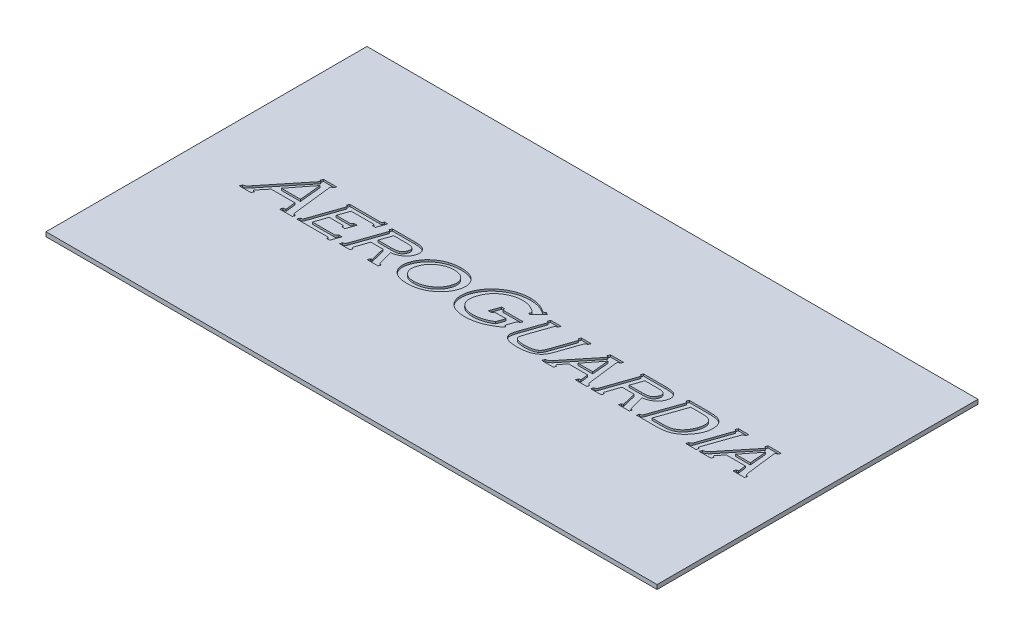
from build123d import *

# Parameters (mm, degrees)
CROQUIS1_W              = 127
CROQUIS1_H              = 66.7
SALIENTE_EXTRUIR1_DEPTH = 0.9
CORTAR_EXTRUIR1_DEPTH   = 0.4


with BuildPart() as part:
    # Croquis1 → Saliente-Extruir1 (new body)
    with BuildSketch(Plane(origin=(0, 0, 0), x_dir=(1, 0, 0), z_dir=(0, 1, 0))):
        Rectangle(CROQUIS1_W, CROQUIS1_H)
    extrude(amount=SALIENTE_EXTRUIR1_DEPTH)

    # Croquis3 → Cortar-Extruir1 (cut)
    # profile 1 of 11: a face of its own
    with BuildSketch(Plane(origin=(0, 0.9, 0), x_dir=(1, 0, 0), z_dir=(0, 1, 0))):
        with BuildLine():
            Line((-42.857045265, -2.280671296), (-47.783704065, -2.280671296))
            Line((-47.783704065, -2.280671296), (-49.202853733, -4.009994394))
            add(Edge.make_bspline(
                [(-49.202853733, -4.009994394), (-49.22631636, -4.040358554), (-49.269957104, -4.096836224), (-49.329113463, -4.176379412), (-49.369059133, -4.248760996), (-49.389338808, -4.293855725), (-49.398305483, -4.313794397)],
                knots=[0, 0, 0, 0, 1.27060263, 2.36333477, 3.276347104, 4, 4, 4, 4], degree=3))
            add(Edge.make_bspline(
                [(-49.398305483, -4.313794397), (-49.398620172, -4.332729031), (-49.39939745, -4.379497467), (-49.314916063, -4.426189025), (-49.201295383, -4.465755337), (-49.103243684, -4.485122136), (-49.045642542, -4.496499295)],
                knots=[0, 0, 0, 0, 0.499150711, 1.232899418, 2.374447809, 4, 4, 4, 4], degree=3))
            Line((-49.045642542, -4.496499295), (-49.219849537, -5))
            Line((-49.219849537, -5), (-51.66724537, -5))
            Line((-51.66724537, -5), (-51.486664949, -4.477379015))
            add(Edge.make_bspline(
                [(-51.486664949, -4.477379015), (-51.427750472, -4.466070937), (-51.317542811, -4.444917615), (-51.165432207, -4.404608003), (-51.040049772, -4.350775925), (-50.928355951, -4.283861408), (-50.820043751, -4.180665363), (-50.689629293, -4.039231537), (-50.524950857, -3.852101659), (-50.40956212, -3.707478423), (-50.345821578, -3.627588795)],
                knots=[0, 0, 0, 0, 0.977889715, 1.829277695, 2.558265342, 3.19570352, 3.939525687, 4.984715282, 6.334361862, 8, 8, 8, 8], degree=3))
            Line((-50.345821578, -3.627588795), (-44.227331995, 3.929170736))
            add(Edge.make_bspline(
                [(-44.227331995, 3.929170736), (-44.197343386, 3.966520406), (-44.143585086, 4.03347432), (-44.075972908, 4.123886072), (-44.029358547, 4.191426597), (-44.009668534, 4.230697454), (-44.002137587, 4.245717593)],
                knots=[0, 0, 0, 0, 1.476455788, 2.646730064, 3.482407465, 4, 4, 4, 4], degree=3))
            add(Edge.make_bspline(
                [(-44.002137587, 4.245717593), (-44.003636248, 4.259185567), (-44.007612171, 4.294915873), (-44.071512263, 4.335677833), (-44.163438788, 4.375018769), (-44.241587404, 4.399425392), (-44.28681731, 4.413551161)],
                knots=[0, 0, 0, 0, 0.45067203, 1.195625252, 2.376918076, 4, 4, 4, 4], degree=3))
            Line((-44.28681731, 4.413551161), (-44.108361364, 4.925549769))
            Line((-44.108361364, 4.925549769), (-41.374161332, 4.925549769))
            Line((-41.374161332, 4.925549769), (-41.539870425, 4.449667245))
            add(Edge.make_bspline(
                [(-41.539870425, 4.449667245), (-41.596425198, 4.432586357), (-41.697720814, 4.40199267), (-41.823168429, 4.344929109), (-41.916416784, 4.293381172), (-41.947526876, 4.244769961), (-41.960516583, 4.224472837)],
                knots=[0, 0, 0, 0, 1.449961783, 2.597035848, 3.414206378, 4, 4, 4, 4], degree=3))
            add(Edge.make_bspline(
                [(-41.960516583, 4.224472837), (-41.96471767, 4.208271556), (-41.974276344, 4.171409013), (-41.973072959, 4.105374475), (-41.972216914, 4.023224792), (-41.96602826, 3.962439828), (-41.962641059, 3.929170736)],
                knots=[0, 0, 0, 0, 0.673759234, 1.532994797, 2.649747917, 4, 4, 4, 4], degree=3))
            Line((-41.962641059, 3.929170736), (-41.121348741, -3.353531449))
            add(Edge.make_bspline(
                [(-41.121348741, -3.353531449), (-41.11396199, -3.420150363), (-41.100040455, -3.545704546), (-41.07441446, -3.721554845), (-41.058709031, -3.874599204), (-41.034215528, -4.003403325), (-41.019833839, -4.110256516), (-41.002409265, -4.193839978), (-40.987711474, -4.25313738), (-40.971905743, -4.308552183), (-40.914106852, -4.360274707), (-40.811233295, -4.40487161), (-40.66494601, -4.462323527), (-40.549580825, -4.493595382), (-40.484006076, -4.511370624)],
                knots=[0, 0, 0, 0, 1.611429521, 3.037001129, 4.272462629, 5.30815527, 6.187134544, 6.865001809, 7.356421471, 7.663374349, 8.229367489, 9.127918274, 10.367479444, 12, 12, 12, 12], degree=3))
            Line((-40.484006076, -4.511370624), (-40.65396412, -5))
            Line((-40.65396412, -5), (-43.305309606, -5))
            Line((-43.305309606, -5), (-43.122604709, -4.473130064))
            add(Edge.make_bspline(
                [(-43.122604709, -4.473130064), (-43.05835677, -4.464169392), (-42.944198334, -4.448247693), (-42.80111719, -4.406799296), (-42.694308426, -4.361004718), (-42.660813886, -4.30833516), (-42.646722186, -4.286176215)],
                knots=[0, 0, 0, 0, 1.46783615, 2.608112912, 3.414410343, 4, 4, 4, 4], degree=3))
            add(Edge.make_bspline(
                [(-42.646722186, -4.286176215), (-42.64245856, -4.268548236), (-42.631840072, -4.224646061), (-42.63690555, -4.143581153), (-42.641200888, -4.036540501), (-42.652918367, -3.956830504), (-42.659469039, -3.912268519)],
                knots=[0, 0, 0, 0, 0.575864585, 1.434180744, 2.56557514, 4, 4, 4, 4], degree=3))
            Line((-42.659469039, -3.912268519), (-42.857045265, -2.280671296))
        make_face()
        Polygon((-42.905908203, -1.05697338), (-43.332927789, 3.459661639), (-46.865930628, -1.05697338), align=None, mode=Mode.SUBTRACT)
    # profile 2 of 11: a face of its own
    with BuildSketch(Plane(origin=(0, 0.9, 0), x_dir=(1, 0, 0), z_dir=(0, 1, 0))):
        with BuildLine():
            Line((-36.664199038, -1.32890625), (-37.558603244, -3.912268519))
            Line((-37.558603244, -3.912268519), (-33.114200394, -3.912268519))
            add(Edge.make_bspline(
                [(-33.114200394, -3.912268519), (-33.076674172, -3.911097597), (-33.007183186, -3.908929286), (-32.911512044, -3.902474408), (-32.834396045, -3.885731766), (-32.768165722, -3.861047467), (-32.707963645, -3.811992596), (-32.646292374, -3.734949907), (-32.571855767, -3.630596845), (-32.52164289, -3.549339524), (-32.493853534, -3.504369213)],
                knots=[0, 0, 0, 0, 1.122520408, 2.078681091, 2.859191742, 3.47623959, 4.170488993, 5.146127306, 6.420578708, 8, 8, 8, 8], degree=3))
            Line((-32.493853534, -3.504369213), (-31.84163954, -3.504369213))
            Line((-31.84163954, -3.504369213), (-32.50022696, -5.407899306))
            Line((-32.50022696, -5.407899306), (-33.152440954, -5.407899306))
            add(Edge.make_bspline(
                [(-33.152440954, -5.407899306), (-33.148479476, -5.363331461), (-33.141440479, -5.284140592), (-33.146217989, -5.180003101), (-33.155232825, -5.105434833), (-33.179674156, -5.052307819), (-33.229089802, -5.027359611), (-33.291823219, -5.0088345), (-33.379071509, -5.003409629), (-33.443544055, -5.001223132), (-33.479610189, -5)],
                knots=[0, 0, 0, 0, 1.612574277, 2.865320509, 3.747269957, 4.330344965, 4.869216906, 5.669309165, 6.696204647, 8, 8, 8, 8], degree=3))
            Line((-33.479610189, -5), (-39.702199074, -5))
            Line((-39.702199074, -5), (-39.525867603, -4.490125868))
            add(Edge.make_bspline(
                [(-39.525867603, -4.490125868), (-39.476211497, -4.476363011), (-39.386865654, -4.45159961), (-39.267517933, -4.412970259), (-39.180449502, -4.370672229), (-39.113277711, -4.32812747), (-39.069988735, -4.267722285), (-39.025875625, -4.197144571), (-38.987740003, -4.104207194), (-38.96198095, -4.036236592), (-38.948010254, -3.999372016)],
                knots=[0, 0, 0, 0, 1.520844372, 2.736443324, 3.689421336, 4.379121119, 5.047940382, 5.85405016, 6.836121364, 8, 8, 8, 8], degree=3))
            Line((-38.948010254, -3.999372016), (-36.815036802, 2.157358127))
            add(Edge.make_bspline(
                [(-36.815036802, 2.157358127), (-36.803350457, 2.194735926), (-36.78234511, 2.261919772), (-36.758942068, 2.353472771), (-36.752310061, 2.424453225), (-36.754210937, 2.484026832), (-36.792912387, 2.529945212), (-36.854258657, 2.569398042), (-36.943596403, 2.611319706), (-37.015088117, 2.633546826), (-37.055102539, 2.645987504)],
                knots=[0, 0, 0, 0, 1.387951546, 2.494740931, 3.325471583, 3.931840595, 4.523520286, 5.351219065, 6.517458423, 8, 8, 8, 8], degree=3))
            Line((-37.055102539, 2.645987504), (-36.876646593, 3.157986111))
            Line((-36.876646593, 3.157986111), (-30.66255561, 3.157986111))
            add(Edge.make_bspline(
                [(-30.66255561, 3.157986111), (-30.625689285, 3.158798279), (-30.557450809, 3.160301577), (-30.463684337, 3.170967492), (-30.386366901, 3.185775152), (-30.321323954, 3.214058823), (-30.260351606, 3.262135142), (-30.19958209, 3.339960908), (-30.121805646, 3.441249752), (-30.070563226, 3.521486963), (-30.042208749, 3.565885417)],
                knots=[0, 0, 0, 0, 1.107269083, 2.049522325, 2.83421265, 3.462901801, 4.160868945, 5.141731851, 6.418406087, 8, 8, 8, 8], degree=3))
            Line((-30.042208749, 3.565885417), (-29.394243707, 3.565885417))
            Line((-29.394243707, 3.565885417), (-30.052831127, 1.662355324))
            Line((-30.052831127, 1.662355324), (-30.70079617, 1.662355324))
            add(Edge.make_bspline(
                [(-30.70079617, 1.662355324), (-30.698927737, 1.706216907), (-30.695582177, 1.784754115), (-30.696900692, 1.888547862), (-30.711984993, 1.963293894), (-30.739428073, 2.015776431), (-30.789253651, 2.043855723), (-30.855843496, 2.05750027), (-30.944086115, 2.06823673), (-31.010217382, 2.06953233), (-31.047085684, 2.07025463)],
                knots=[0, 0, 0, 0, 1.564715677, 2.801732035, 3.68277648, 4.271101546, 4.837945595, 5.645514958, 6.687370283, 8, 8, 8, 8], degree=3))
            Line((-31.047085684, 2.07025463), (-35.487239583, 2.07025463))
            Line((-35.487239583, 2.07025463), (-36.28604239, -0.241174769))
            Line((-36.28604239, -0.241174769), (-33.604954246, -0.241174769))
            add(Edge.make_bspline(
                [(-33.604954246, -0.241174769), (-33.567403446, -0.240320235), (-33.498500076, -0.23875222), (-33.404431982, -0.228837775), (-33.328861884, -0.212158197), (-33.263364462, -0.18842726), (-33.205052469, -0.137280853), (-33.141383727, -0.0631241), (-33.066453442, 0.041423228), (-33.015302653, 0.121818784), (-32.986731861, 0.166724537)],
                knots=[0, 0, 0, 0, 1.129301717, 2.07219799, 2.836652384, 3.457427908, 4.139118115, 5.1346386, 6.399523336, 8, 8, 8, 8], degree=3))
            Line((-32.986731861, 0.166724537), (-32.338766819, 0.166724537))
            Line((-32.338766819, 0.166724537), (-32.997354239, -1.736805556))
            Line((-32.997354239, -1.736805556), (-33.645319282, -1.736805556))
            add(Edge.make_bspline(
                [(-33.645319282, -1.736805556), (-33.642905524, -1.69286392), (-33.63858154, -1.614147278), (-33.645509108, -1.511293412), (-33.655308854, -1.434752006), (-33.686387942, -1.383931414), (-33.73505784, -1.355580412), (-33.799703986, -1.341738614), (-33.884317317, -1.330869277), (-33.947647061, -1.329610916), (-33.983110894, -1.32890625)],
                knots=[0, 0, 0, 0, 1.587667027, 2.844132083, 3.732587044, 4.343104417, 4.91826297, 5.712921246, 6.719265656, 8, 8, 8, 8], degree=3))
            Line((-33.983110894, -1.32890625), (-36.664199038, -1.32890625))
        make_face()
    # profile 3 of 11: a face of its own
    with BuildSketch(Plane(origin=(0, 0.9, 0), x_dir=(1, 0, 0), z_dir=(0, 1, 0))):
        with BuildLine():
            Line((-27.873119213, -1.464872685), (-28.752652091, -4.007869918))
            add(Edge.make_bspline(
                [(-28.752652091, -4.007869918), (-28.76642404, -4.049467407), (-28.790973729, -4.123618525), (-28.819365954, -4.223722668), (-28.827164576, -4.298630011), (-28.829328852, -4.359792909), (-28.788648297, -4.404358986), (-28.725764883, -4.440731428), (-28.633791039, -4.480169883), (-28.561652061, -4.504219562), (-28.521084256, -4.51774405)],
                knots=[0, 0, 0, 0, 1.487715422, 2.651981243, 3.497507454, 4.075543846, 4.622865785, 5.421800081, 6.550133163, 8, 8, 8, 8], degree=3))
            Line((-28.521084256, -4.51774405), (-28.688917824, -5))
            Line((-28.688917824, -5), (-30.864380787, -5))
            Line((-30.864380787, -5), (-30.688049316, -4.490125868))
            add(Edge.make_bspline(
                [(-30.688049316, -4.490125868), (-30.63839321, -4.476363011), (-30.549047367, -4.45159961), (-30.429699646, -4.412970259), (-30.342631215, -4.370672229), (-30.275459424, -4.32812747), (-30.232170448, -4.267722285), (-30.188057338, -4.197144571), (-30.149921716, -4.104207194), (-30.124162663, -4.036236592), (-30.110191967, -3.999372016)],
                knots=[0, 0, 0, 0, 1.520844372, 2.736443324, 3.689421336, 4.379121119, 5.047940382, 5.85405016, 6.836121364, 8, 8, 8, 8], degree=3))
            Line((-30.110191967, -3.999372016), (-27.977218515, 2.157358127))
            add(Edge.make_bspline(
                [(-27.977218515, 2.157358127), (-27.96553217, 2.194735926), (-27.944526823, 2.261919772), (-27.921123781, 2.353472771), (-27.914491774, 2.424453225), (-27.91639265, 2.484026832), (-27.9550941, 2.529945212), (-28.01644037, 2.569398042), (-28.105778116, 2.611319706), (-28.17726983, 2.633546826), (-28.217284252, 2.645987504)],
                knots=[0, 0, 0, 0, 1.387951546, 2.494740931, 3.325471583, 3.931840595, 4.523520286, 5.351219065, 6.517458423, 8, 8, 8, 8], degree=3))
            Line((-28.217284252, 2.645987504), (-28.038828306, 3.157986111))
            Line((-28.038828306, 3.157986111), (-23.33948839, 3.157986111))
            add(Edge.make_bspline(
                [(-23.33948839, 3.157986111), (-23.210561556, 3.15635637), (-22.964519333, 3.153246194), (-22.615648874, 3.130157883), (-22.304426354, 3.093673035), (-22.031149499, 3.038168524), (-21.789330887, 2.969897874), (-21.579753556, 2.879265584), (-21.394846631, 2.775606066), (-21.293672958, 2.685368436), (-21.244755498, 2.641738553)],
                knots=[0, 0, 0, 0, 1.402430304, 2.676379005, 3.802004197, 4.808227912, 5.707727053, 6.529112621, 7.288826115, 8, 8, 8, 8], degree=3))
            add(Edge.make_bspline(
                [(-21.244755498, 2.641738553), (-21.1909933, 2.586082718), (-21.086218273, 2.477617255), (-20.96544085, 2.287453463), (-20.877824638, 2.083694196), (-20.82139491, 1.865218054), (-20.803461034, 1.631236905), (-20.820173582, 1.384424023), (-20.866959897, 1.121824852), (-20.922552356, 0.946561693), (-20.951577872, 0.855054615)],
                knots=[0, 0, 0, 0, 0.963655076, 1.8780294, 2.79244643, 3.722698331, 4.680459438, 5.707477261, 6.80304532, 8, 8, 8, 8], degree=3))
            add(Edge.make_bspline(
                [(-20.951577872, 0.855054615), (-20.979589871, 0.780288696), (-21.035391422, 0.631350586), (-21.136748529, 0.416532853), (-21.257813099, 0.214098228), (-21.390301352, 0.019815615), (-21.542619696, -0.160852027), (-21.70949625, -0.331122055), (-21.889414311, -0.493824349), (-22.087106404, -0.64085606), (-22.294025573, -0.775550135), (-22.50654959, -0.898294955), (-22.727120603, -1.001370322), (-22.951685233, -1.094266978), (-23.183780911, -1.167595281), (-23.420632, -1.227545861), (-23.66331291, -1.272844909), (-23.827969169, -1.290342876), (-23.910972313, -1.299163592)],
                knots=[0, 0, 0, 0, 0.990015786, 1.972169679, 2.940720332, 3.912808682, 4.885531659, 5.866860525, 6.868303152, 7.890633647, 8.918645158, 9.929594152, 10.931383345, 11.936055944, 12.941534415, 13.946974525, 14.96507081, 16, 16, 16, 16], degree=3))
            Line((-23.910972313, -1.299163592), (-23.139787688, -4.224566424))
            add(Edge.make_bspline(
                [(-23.139787688, -4.224566424), (-23.132747651, -4.249300316), (-23.120203219, -4.293372895), (-23.103248052, -4.351764701), (-23.083235025, -4.389127779), (-23.065346057, -4.422210227), (-23.013762691, -4.430784901), (-22.937980425, -4.449571187), (-22.815373353, -4.469489544), (-22.720454955, -4.482605374), (-22.66602964, -4.490125868)],
                knots=[0, 0, 0, 0, 1.008579536, 1.797157655, 2.35476659, 2.692983524, 3.192493186, 4.241371987, 5.844838102, 8, 8, 8, 8], degree=3))
            Line((-22.66602964, -4.490125868), (-22.842361111, -5))
            Line((-22.842361111, -5), (-25.107052047, -5))
            Line((-25.107052047, -5), (-24.928596101, -4.481627966))
            add(Edge.make_bspline(
                [(-24.928596101, -4.481627966), (-24.886897941, -4.472731527), (-24.815588923, -4.457517516), (-24.72556187, -4.442874245), (-24.672338176, -4.42880797), (-24.648170816, -4.423534555), (-24.641791902, -4.42214265)],
                knots=[0, 0, 0, 0, 1.74651846, 2.986762849, 3.7325586, 4, 4, 4, 4], degree=3))
            add(Edge.make_bspline(
                [(-24.641791902, -4.42214265), (-24.640732703, -4.411517523), (-24.637899446, -4.383096307), (-24.646799385, -4.329411795), (-24.664683606, -4.254774663), (-24.679875238, -4.197635179), (-24.688530364, -4.165081109)],
                knots=[0, 0, 0, 0, 0.486299009, 1.300804083, 2.462187508, 4, 4, 4, 4], degree=3))
            Line((-24.688530364, -4.165081109), (-25.34924226, -1.464872685))
            Line((-25.34924226, -1.464872685), (-27.873119213, -1.464872685))
        make_face()
        with BuildLine():
            Line((-27.497087041, -0.377141204), (-24.900977919, -0.377141204))
            add(Edge.make_bspline(
                [(-24.900977919, -0.377141204), (-24.793320094, -0.377258905), (-24.592104925, -0.377478892), (-24.312375292, -0.36574194), (-24.074825092, -0.352361694), (-23.821311313, -0.325593548), (-23.548667806, -0.273348265), (-23.353413695, -0.193863546), (-23.260882794, -0.156195747)],
                knots=[0, 0, 0, 0, 1.161849723, 2.171526212, 3.021649321, 3.729000858, 4.923773776, 6, 6, 6, 6], degree=3))
            add(Edge.make_bspline(
                [(-23.260882794, -0.156195747), (-23.215692197, -0.133119508), (-23.12602649, -0.087332388), (-23.00141267, -0.000685325), (-22.88755573, 0.099103677), (-22.782197375, 0.210210375), (-22.688473557, 0.334342983), (-22.605434477, 0.471076593), (-22.532996128, 0.620796559), (-22.493124081, 0.726538784), (-22.472702365, 0.780697971)],
                knots=[0, 0, 0, 0, 0.96683567, 1.918363767, 2.885199437, 3.850146755, 4.833350818, 5.845531262, 6.896521454, 8, 8, 8, 8], degree=3))
            add(Edge.make_bspline(
                [(-22.472702365, 0.780697971), (-22.456337754, 0.83287992), (-22.424798116, 0.933450586), (-22.392008987, 1.081698697), (-22.37790908, 1.220989351), (-22.385265022, 1.349425797), (-22.404607806, 1.468414144), (-22.446228902, 1.575945707), (-22.504181425, 1.674071498), (-22.555199165, 1.729745747), (-22.581050618, 1.757956724)],
                knots=[0, 0, 0, 0, 1.26063774, 2.42963666, 3.495552563, 4.476533608, 5.389368402, 6.262794378, 7.119731868, 8, 8, 8, 8], degree=3))
            add(Edge.make_bspline(
                [(-22.581050618, 1.757956724), (-22.609970692, 1.783204645), (-22.671951474, 1.837315361), (-22.788998985, 1.897951959), (-22.924822237, 1.954388223), (-23.085323514, 1.995248799), (-23.267753947, 2.02866744), (-23.473458426, 2.053833971), (-23.701846074, 2.068579599), (-23.861377698, 2.069678738), (-23.944963921, 2.07025463)],
                knots=[0, 0, 0, 0, 0.643291804, 1.378686979, 2.201056129, 3.113607846, 4.154975475, 5.318529309, 6.595049666, 8, 8, 8, 8], degree=3))
            Line((-23.944963921, 2.07025463), (-26.649421296, 2.07025463))
            Line((-26.649421296, 2.07025463), (-27.497087041, -0.377141204))
        make_face(mode=Mode.SUBTRACT)
    # profile 4 of 11: a face of its own
    with BuildSketch(Plane(origin=(0, 0.9, 0), x_dir=(1, 0, 0), z_dir=(0, 1, 0))):
        with BuildLine():
            add(Edge.make_bspline(
                [(-13.870700864, 3.291828071), (-13.689978378, 3.289003273), (-13.341145883, 3.283550819), (-12.838870874, 3.229741402), (-12.377405029, 3.143685325), (-11.955341692, 3.024525896), (-11.574695702, 2.864507787), (-11.234358845, 2.670175997), (-10.930489388, 2.444020126), (-10.764158254, 2.260770758), (-10.681863064, 2.17010498)],
                knots=[0, 0, 0, 0, 1.242618393, 2.398515446, 3.46935357, 4.468221998, 5.409007861, 6.3013017, 7.159539793, 8, 8, 8, 8], degree=3))
            add(Edge.make_bspline(
                [(-10.681863064, 2.17010498), (-10.600818884, 2.066028297), (-10.440631352, 1.860315971), (-10.256861978, 1.516231336), (-10.128188828, 1.150757445), (-10.053749716, 0.764175018), (-10.033748477, 0.356132857), (-10.066808501, -0.072599094), (-10.155643029, -0.521773195), (-10.250419394, -0.821277379), (-10.299457465, -0.976243309)],
                knots=[0, 0, 0, 0, 0.949945756, 1.877611255, 2.79827796, 3.734743722, 4.706405329, 5.735754666, 6.828460835, 8, 8, 8, 8], degree=3))
            add(Edge.make_bspline(
                [(-10.299457465, -0.976243309), (-10.335312172, -1.075375564), (-10.407393915, -1.274669504), (-10.547246798, -1.563425064), (-10.700608268, -1.851864261), (-10.880888286, -2.133163482), (-11.078002857, -2.413485154), (-11.300966235, -2.68674531), (-11.541384732, -2.95954344), (-11.716816908, -3.132201465), (-11.80571063, -3.219689489)],
                knots=[0, 0, 0, 0, 0.927094407, 1.863816134, 2.820273441, 3.800614028, 4.801828818, 5.834494622, 6.902710798, 8, 8, 8, 8], degree=3))
            add(Edge.make_bspline(
                [(-11.80571063, -3.219689489), (-11.888451675, -3.297798824), (-12.053100718, -3.453231079), (-12.313937521, -3.669340083), (-12.580118236, -3.873522771), (-12.855571522, -4.061023776), (-13.138421873, -4.233461393), (-13.429947725, -4.390705329), (-13.728841936, -4.533368467), (-14.036668428, -4.658329071), (-14.350395307, -4.771158916), (-14.672846412, -4.869631108), (-15.00347566, -4.951531801), (-15.341362002, -5.020559299), (-15.687727866, -5.070164287), (-16.041142592, -5.109658521), (-16.40354734, -5.129988217), (-16.647370166, -5.133959272), (-16.77060999, -5.135966435)],
                knots=[0, 0, 0, 0, 0.999505372, 1.988947601, 2.974547931, 3.946163759, 4.915086328, 5.883909004, 6.855225949, 7.823489027, 8.801617577, 9.78377494, 10.784286863, 11.793429031, 12.812401822, 13.857501792, 14.917078005, 16, 16, 16, 16], degree=3))
            add(Edge.make_bspline(
                [(-16.77060999, -5.135966435), (-16.943568475, -5.133232841), (-17.276912671, -5.127964365), (-17.758431973, -5.072853771), (-18.203079435, -4.989058737), (-18.60987421, -4.864444999), (-18.98058372, -4.709604644), (-19.310390751, -4.512271905), (-19.609245161, -4.28764988), (-19.773750709, -4.104893749), (-19.855348488, -4.014243345)],
                knots=[0, 0, 0, 0, 1.223960428, 2.358948198, 3.426749249, 4.422715904, 5.366073925, 6.262880694, 7.138356853, 8, 8, 8, 8], degree=3))
            add(Edge.make_bspline(
                [(-19.855348488, -4.014243345), (-19.93369204, -3.913041017), (-20.088947298, -3.712485986), (-20.26313182, -3.374436001), (-20.385480444, -3.015643655), (-20.455283894, -2.635636577), (-20.47397629, -2.234820546), (-20.437696737, -1.813393227), (-20.349522022, -1.370530657), (-20.254948825, -1.07455214), (-20.205886954, -0.921006944)],
                knots=[0, 0, 0, 0, 0.938824836, 1.860491239, 2.778699274, 3.715589785, 4.689770982, 5.718236288, 6.816286195, 8, 8, 8, 8], degree=3))
            add(Edge.make_bspline(
                [(-20.205886954, -0.921006944), (-20.167895659, -0.814814663), (-20.092097197, -0.602944767), (-19.948429003, -0.296973071), (-19.792484638, 0.003430285), (-19.615442979, 0.294871981), (-19.419020638, 0.578149646), (-19.205036132, 0.853461198), (-18.972396533, 1.121610093), (-18.804065204, 1.290139569), (-18.718754069, 1.375551125)],
                knots=[0, 0, 0, 0, 0.979832192, 1.954915557, 2.935134392, 3.921153903, 4.916639234, 5.930006254, 6.950917123, 8, 8, 8, 8], degree=3))
            add(Edge.make_bspline(
                [(-18.718754069, 1.375551125), (-18.625532898, 1.463023988), (-18.439457604, 1.6376253), (-18.143665556, 1.879714555), (-17.834802353, 2.102350164), (-17.515967974, 2.309640379), (-17.183896422, 2.496985786), (-16.838965364, 2.663703742), (-16.484032528, 2.816884661), (-16.239373881, 2.901060297), (-16.116271521, 2.943414081)],
                knots=[0, 0, 0, 0, 1.000934939, 1.997928811, 2.990795606, 3.981475996, 4.974807363, 5.974389313, 6.980794427, 8, 8, 8, 8], degree=3))
            add(Edge.make_bspline(
                [(-16.116271521, 2.943414081), (-15.943511016, 2.995155164), (-15.592246872, 3.100357378), (-15.042553115, 3.206365142), (-14.465742545, 3.273088667), (-14.072003957, 3.285488515), (-13.870700864, 3.291828071)],
                knots=[0, 0, 0, 0, 0.948331746, 1.92818919, 2.940764415, 4, 4, 4, 4], degree=3))
        make_face()
        with BuildLine():
            add(Edge.make_bspline(
                [(-14.246733037, 2.206221065), (-14.375079372, 2.203773358), (-14.630599009, 2.198900317), (-15.009841216, 2.146971883), (-15.382773607, 2.068731905), (-15.750682415, 1.960163537), (-16.111725205, 1.817712739), (-16.465312118, 1.640837912), (-16.815400527, 1.43894994), (-17.036743047, 1.279778075), (-17.148766638, 1.199219654)],
                knots=[0, 0, 0, 0, 0.984748492, 1.960496774, 2.932922589, 3.908246712, 4.901646162, 5.908212994, 6.94132636, 8, 8, 8, 8], degree=3))
            add(Edge.make_bspline(
                [(-17.148766638, 1.199219654), (-17.239042301, 1.128958966), (-17.417541639, 0.990034632), (-17.665521215, 0.76065919), (-17.892261524, 0.51667547), (-18.099708241, 0.258774138), (-18.285048688, -0.014085091), (-18.448904106, -0.301843049), (-18.592274029, -0.604518455), (-18.670691414, -0.814874024), (-18.710256167, -0.921006944)],
                knots=[0, 0, 0, 0, 1.026480091, 2.029628041, 3.028112931, 4.013891238, 4.997679586, 5.985587007, 6.983646902, 8, 8, 8, 8], degree=3))
            add(Edge.make_bspline(
                [(-18.710256167, -0.921006944), (-18.743916158, -1.02603087), (-18.809008113, -1.229126958), (-18.874319106, -1.532044532), (-18.913838468, -1.820619465), (-18.914056719, -2.094976546), (-18.891463768, -2.355971913), (-18.830549602, -2.600647112), (-18.741719898, -2.832211452), (-18.658490914, -2.972866342), (-18.616779243, -3.043358019)],
                knots=[0, 0, 0, 0, 1.201387586, 2.323252699, 3.37350203, 4.369239941, 5.30778029, 6.22135875, 7.108602607, 8, 8, 8, 8], degree=3))
            add(Edge.make_bspline(
                [(-18.616779243, -3.043358019), (-18.559595787, -3.123849555), (-18.44634947, -3.283255279), (-18.236481672, -3.488465635), (-17.99962693, -3.662518458), (-17.734246477, -3.806385862), (-17.437874039, -3.913256613), (-17.115167096, -3.991047341), (-16.764409553, -4.041747581), (-16.520815491, -4.046020566), (-16.394577818, -4.048234954)],
                knots=[0, 0, 0, 0, 0.928352706, 1.838512987, 2.74955246, 3.689522525, 4.670702177, 5.707533392, 6.811975754, 8, 8, 8, 8], degree=3))
            add(Edge.make_bspline(
                [(-16.394577818, -4.048234954), (-16.257746505, -4.045790454), (-15.986019921, -4.040936043), (-15.584080338, -3.989432742), (-15.19143479, -3.910843087), (-14.807488011, -3.803575027), (-14.435305118, -3.659543706), (-14.072294508, -3.48655058), (-13.718087432, -3.283441936), (-13.494806122, -3.123907091), (-13.382071488, -3.043358019)],
                knots=[0, 0, 0, 0, 1.015586034, 2.01680243, 3.003762195, 3.987578858, 4.972982357, 5.963242813, 6.971642201, 8, 8, 8, 8], degree=3))
            add(Edge.make_bspline(
                [(-13.382071488, -3.043358019), (-13.287618731, -2.970187462), (-13.101177313, -2.825755232), (-12.842857594, -2.592138546), (-12.606713609, -2.348961004), (-12.39638567, -2.093437125), (-12.208502247, -1.827326347), (-12.044701491, -1.550171175), (-11.902635683, -1.262932046), (-11.82811685, -1.063340697), (-11.790839301, -0.963496455)],
                knots=[0, 0, 0, 0, 1.078124787, 2.128123321, 3.140722991, 4.135102541, 5.112239843, 6.078021544, 7.038543096, 8, 8, 8, 8], degree=3))
            add(Edge.make_bspline(
                [(-11.790839301, -0.963496455), (-11.756391806, -0.85637749), (-11.689993273, -0.649902623), (-11.623798709, -0.341275926), (-11.58761782, -0.047439898), (-11.588344474, 0.231962043), (-11.616391225, 0.497133961), (-11.680659627, 0.747517449), (-11.778427979, 0.983625996), (-11.867435918, 1.127361001), (-11.911934408, 1.199219654)],
                knots=[0, 0, 0, 0, 1.199634452, 2.312329699, 3.361763487, 4.351336138, 5.286476129, 6.198884268, 7.099553021, 8, 8, 8, 8], degree=3))
            add(Edge.make_bspline(
                [(-11.911934408, 1.199219654), (-11.970487422, 1.279114336), (-12.086881843, 1.437932718), (-12.304640406, 1.641960985), (-12.552402503, 1.814674775), (-12.831987761, 1.95497722), (-13.141525948, 2.066018421), (-13.482195372, 2.145500802), (-13.854445901, 2.194353262), (-14.112736515, 2.202167288), (-14.246733037, 2.206221065)],
                knots=[0, 0, 0, 0, 0.895687218, 1.780488924, 2.688065155, 3.623307989, 4.605423166, 5.660342088, 6.786227586, 8, 8, 8, 8], degree=3))
        make_face(mode=Mode.SUBTRACT)
    # profile 5 of 11: a face of its own
    with BuildSketch(Plane(origin=(0, 0.9, 0), x_dir=(1, 0, 0), z_dir=(0, 1, 0))):
        with BuildLine():
            Line((3.479890951, 3.873934371), (1.657090929, 1.985275608))
            Line((1.657090929, 1.985275608), (1.291681134, 2.20834554))
            add(Edge.make_bspline(
                [(1.291681134, 2.20834554), (1.326060995, 2.251980633), (1.386488172, 2.328675112), (1.461158438, 2.43274454), (1.514376363, 2.505954639), (1.534922427, 2.549481377), (1.542369249, 2.565257433)],
                knots=[0, 0, 0, 0, 1.524892475, 2.680201381, 3.521645373, 4, 4, 4, 4], degree=3))
            add(Edge.make_bspline(
                [(1.542369249, 2.565257433), (1.544185082, 2.578126493), (1.548264412, 2.607037269), (1.526356089, 2.653748938), (1.488565573, 2.704682019), (1.432769488, 2.76390509), (1.357712359, 2.82936233), (1.263139163, 2.901138075), (1.151094116, 2.982081799), (1.068168459, 3.035862381), (1.023997215, 3.064509187)],
                knots=[0, 0, 0, 0, 0.412031692, 0.925643064, 1.597840722, 2.471144561, 3.539741733, 4.810633844, 6.301149812, 8, 8, 8, 8], degree=3))
            add(Edge.make_bspline(
                [(1.023997215, 3.064509187), (0.925764314, 3.126277566), (0.729893555, 3.249440162), (0.420195405, 3.405817256), (0.101830726, 3.540444417), (-0.2279981, 3.649017912), (-0.56728758, 3.734304716), (-0.916884442, 3.792810564), (-1.275990086, 3.830402158), (-1.51890466, 3.835321166), (-1.6422196, 3.837818287)],
                knots=[0, 0, 0, 0, 0.988320372, 1.970654005, 2.952394374, 3.931311829, 4.926516336, 5.930463658, 6.949405366, 8, 8, 8, 8], degree=3))
            add(Edge.make_bspline(
                [(-1.6422196, 3.837818287), (-1.778999743, 3.834880366), (-2.052572865, 3.829004248), (-2.460512256, 3.783898786), (-2.863221708, 3.705830119), (-3.262844724, 3.602389815), (-3.65789436, 3.465371953), (-4.049080508, 3.299566803), (-4.435887962, 3.103411589), (-4.685405647, 2.952140879), (-4.81193712, 2.875430863)],
                knots=[0, 0, 0, 0, 0.977568384, 1.955228497, 2.92910746, 3.907618938, 4.903287889, 5.914886922, 6.942630347, 8, 8, 8, 8], degree=3))
            add(Edge.make_bspline(
                [(-4.81193712, 2.875430863), (-4.946689044, 2.786333506), (-5.213343829, 2.610022578), (-5.582091887, 2.308046096), (-5.919401086, 1.979371756), (-6.225886775, 1.624026753), (-6.500921075, 1.242247756), (-6.744063748, 0.834349026), (-6.955597861, 0.399854784), (-7.069830693, 0.095492203), (-7.127615469, -0.058469871)],
                knots=[0, 0, 0, 0, 1.016573428, 2.011653435, 2.995381392, 3.978553471, 4.962301637, 5.954049809, 6.965054327, 8, 8, 8, 8], degree=3))
            add(Edge.make_bspline(
                [(-7.127615469, -0.058469871), (-7.175582864, -0.207133485), (-7.267795703, -0.492925408), (-7.358566434, -0.917576043), (-7.399486186, -1.317227691), (-7.398324978, -1.691276137), (-7.345633434, -2.041140431), (-7.242298688, -2.363506073), (-7.096543425, -2.664224945), (-6.960299269, -2.837345936), (-6.891798683, -2.924387388)],
                knots=[0, 0, 0, 0, 1.242636037, 2.388851809, 3.448158425, 4.434474872, 5.358269894, 6.251225727, 7.120754503, 8, 8, 8, 8], degree=3))
            add(Edge.make_bspline(
                [(-6.891798683, -2.924387388), (-6.818885157, -3.003852694), (-6.672870674, -3.162987576), (-6.413350678, -3.361900391), (-6.129086612, -3.533104924), (-5.816267694, -3.674191037), (-5.473921209, -3.782316772), (-5.102766878, -3.856826557), (-4.703444328, -3.905151658), (-4.427556652, -3.909844682), (-4.285067184, -3.912268519)],
                knots=[0, 0, 0, 0, 0.897712029, 1.797731681, 2.714122425, 3.66014426, 4.651669017, 5.700782227, 6.812508332, 8, 8, 8, 8], degree=3))
            add(Edge.make_bspline(
                [(-4.285067184, -3.912268519), (-4.121316817, -3.908578793), (-3.792826314, -3.90117704), (-3.299959194, -3.841093441), (-2.806494554, -3.745612635), (-2.317169137, -3.612858539), (-1.844077565, -3.445268884), (-1.39433362, -3.256263195), (-0.977589397, -3.036978605), (-0.719705246, -2.869003687), (-0.592728678, -2.786296477)],
                knots=[0, 0, 0, 0, 1.003597796, 2.013261718, 3.039211369, 4.082863987, 5.118112673, 6.113971772, 7.071360572, 8, 8, 8, 8], degree=3))
            Line((-0.592728678, -2.786296477), (-0.042489511, -1.192939815))
            Line((-0.042489511, -1.192939815), (-2.160591634, -1.192939815))
            add(Edge.make_bspline(
                [(-2.160591634, -1.192939815), (-2.209698767, -1.194344956), (-2.290073338, -1.196644776), (-2.392861407, -1.21347636), (-2.45156239, -1.27209432), (-2.506822786, -1.348480827), (-2.583582885, -1.460849655), (-2.637709938, -1.550247481), (-2.668341291, -1.60083912)],
                knots=[0, 0, 0, 0, 1.266913688, 2.073581524, 2.534259839, 3.332996045, 4.490700414, 6, 6, 6, 6], degree=3))
            Line((-2.668341291, -1.60083912), (-3.309932907, -1.60083912))
            Line((-3.309932907, -1.60083912), (-2.604607024, 0.438657407))
            Line((-2.604607024, 0.438657407), (-1.965139884, 0.438657407))
            add(Edge.make_bspline(
                [(-1.965139884, 0.438657407), (-1.968187988, 0.387824018), (-1.973476779, 0.299622567), (-1.977757973, 0.184876347), (-1.972357883, 0.112270966), (-1.962761215, 0.060452541), (-1.923480713, 0.044319116), (-1.877093793, 0.038535425), (-1.812266934, 0.031156916), (-1.763311225, 0.030901932), (-1.735696524, 0.030758102)],
                knots=[0, 0, 0, 0, 2.027266949, 3.517528264, 4.505095898, 5.011912635, 5.426998089, 6.055626884, 6.903227395, 8, 8, 8, 8], degree=3))
            Line((-1.735696524, 0.030758102), (2.285935692, 0.030758102))
            Line((2.285935692, 0.030758102), (2.118102123, -0.453622323))
            add(Edge.make_bspline(
                [(2.118102123, -0.453622323), (2.066985561, -0.466570195), (1.975490618, -0.489745948), (1.85491654, -0.527219452), (1.767350728, -0.563610158), (1.704439417, -0.602970666), (1.66165524, -0.658171815), (1.625796421, -0.73329639), (1.579636275, -0.829646381), (1.554214568, -0.905059476), (1.540244774, -0.946500651)],
                knots=[0, 0, 0, 0, 1.537560071, 2.752121169, 3.676688419, 4.300932474, 4.887863405, 5.682213908, 6.726324932, 8, 8, 8, 8], degree=3))
            Line((1.540244774, -0.946500651), (1.134469944, -2.119211155))
            add(Edge.make_bspline(
                [(1.134469944, -2.119211155), (1.120645432, -2.160065476), (1.095833454, -2.233390062), (1.067953731, -2.332406798), (1.060178942, -2.40545571), (1.057301202, -2.464934689), (1.100499953, -2.504699387), (1.16096332, -2.542555436), (1.256040305, -2.577963403), (1.329174875, -2.601169107), (1.37028673, -2.614213958)],
                knots=[0, 0, 0, 0, 1.479667922, 2.655680817, 3.485655655, 4.045367792, 4.560798558, 5.367793848, 6.520332078, 8, 8, 8, 8], degree=3))
            Line((1.37028673, -2.614213958), (1.244942672, -2.977499277))
            add(Edge.make_bspline(
                [(1.244942672, -2.977499277), (1.06188581, -3.105160996), (0.707815341, -3.352085609), (0.177916408, -3.683417494), (-0.322463172, -3.979212113), (-0.655519747, -4.146287961), (-0.815798611, -4.2266909)],
                knots=[0, 0, 0, 0, 1.109990417, 2.146954895, 3.108247703, 4, 4, 4, 4], degree=3))
            add(Edge.make_bspline(
                [(-0.815798611, -4.2266909), (-0.970769172, -4.299411819), (-1.279838786, -4.444444697), (-1.756096838, -4.627089763), (-2.236891949, -4.786258449), (-2.724708893, -4.912881914), (-3.218076582, -5.013972868), (-3.717729017, -5.082759122), (-4.223361994, -5.127181674), (-4.56257223, -5.133024927), (-4.733331525, -5.135966435)],
                knots=[0, 0, 0, 0, 1.012477576, 2.019261292, 3.015590757, 4.007408624, 4.999155697, 5.993386417, 6.989865623, 8, 8, 8, 8], degree=3))
            add(Edge.make_bspline(
                [(-4.733331525, -5.135966435), (-4.930368973, -5.132010551), (-5.310597274, -5.124376777), (-5.859499978, -5.062639993), (-6.365815837, -4.960144215), (-6.828880283, -4.81374904), (-7.249973913, -4.627685701), (-7.62436436, -4.395320154), (-7.960585622, -4.126371363), (-8.144816545, -3.911138922), (-8.236591706, -3.803920265)],
                knots=[0, 0, 0, 0, 1.218540281, 2.351448952, 3.411561353, 4.409005722, 5.35013049, 6.250929729, 7.128695639, 8, 8, 8, 8], degree=3))
            add(Edge.make_bspline(
                [(-8.236591706, -3.803920265), (-8.318013208, -3.69136644), (-8.481442298, -3.465448607), (-8.664790115, -3.082898399), (-8.804143353, -2.669788074), (-8.853124923, -2.378634602), (-8.878183322, -2.229683883)],
                knots=[0, 0, 0, 0, 0.96775811, 1.942482307, 2.947397957, 4, 4, 4, 4], degree=3))
            add(Edge.make_bspline(
                [(-8.878183322, -2.229683883), (-8.88788192, -2.14196577), (-8.90739466, -1.965484507), (-8.914827278, -1.69782455), (-8.906288595, -1.426128068), (-8.880929922, -1.151538026), (-8.837795839, -0.872828198), (-8.777626586, -0.5916523), (-8.704603442, -0.305041879), (-8.640787075, -0.116161241), (-8.608374928, -0.020229311)],
                knots=[0, 0, 0, 0, 0.942765356, 1.896762412, 2.858323281, 3.846292739, 4.841654169, 5.870206687, 6.918284142, 8, 8, 8, 8], degree=3))
            add(Edge.make_bspline(
                [(-8.608374928, -0.020229311), (-8.558028553, 0.117992765), (-8.457452134, 0.394117541), (-8.269847971, 0.792791133), (-8.061277068, 1.182266478), (-7.826069502, 1.559391697), (-7.563173656, 1.924650253), (-7.273755211, 2.276008021), (-6.961181074, 2.618874182), (-6.734579993, 2.832927556), (-6.619865813, 2.941289605)],
                knots=[0, 0, 0, 0, 0.979088251, 1.955914209, 2.930632322, 3.919808768, 4.91307911, 5.925001026, 6.949555737, 8, 8, 8, 8], degree=3))
            add(Edge.make_bspline(
                [(-6.619865813, 2.941289605), (-6.509652152, 3.038046686), (-6.290198262, 3.230706269), (-5.944555861, 3.498460786), (-5.587834752, 3.747652985), (-5.217656857, 3.975596498), (-4.83394259, 4.180533524), (-4.441010993, 4.371026511), (-4.034755094, 4.539889637), (-3.755946613, 4.633965846), (-3.615857386, 4.68123508)],
                knots=[0, 0, 0, 0, 1.00607523, 2.00326459, 2.998000574, 3.990503115, 4.984004198, 5.981501285, 6.985791526, 8, 8, 8, 8], degree=3))
            add(Edge.make_bspline(
                [(-3.615857386, 4.68123508), (-3.417672014, 4.739695078), (-3.024099985, 4.855789519), (-2.422570933, 4.972112457), (-1.819130837, 5.048774233), (-1.415135798, 5.057268001), (-1.213075539, 5.061516204)],
                knots=[0, 0, 0, 0, 1.014895412, 2.015458777, 3.007421194, 4, 4, 4, 4], degree=3))
            add(Edge.make_bspline(
                [(-1.213075539, 5.061516204), (-1.035933141, 5.058190558), (-0.69156687, 5.051725474), (-0.189847139, 5.003497158), (0.280266046, 4.918471924), (0.725417519, 4.800696559), (1.151838707, 4.645278384), (1.57109229, 4.454734645), (1.985921546, 4.226153703), (2.251180728, 4.046055145), (2.385786042, 3.954664442)],
                knots=[0, 0, 0, 0, 1.109519626, 2.156915238, 3.153156623, 4.0989412, 5.037667583, 5.992520967, 6.98130823, 8, 8, 8, 8], degree=3))
            add(Edge.make_bspline(
                [(2.385786042, 3.954664442), (2.416980301, 3.93311936), (2.469595052, 3.896779689), (2.526482986, 3.847821106), (2.568682272, 3.824095206), (2.572158271, 3.806731971), (2.572739891, 3.803826678)],
                knots=[0, 0, 0, 0, 1.85914231, 3.13577927, 3.855394792, 4, 4, 4, 4], degree=3))
            add(Edge.make_bspline(
                [(2.572739891, 3.803826678), (2.587101752, 3.809835751), (2.632157596, 3.828687334), (2.712471225, 3.889368195), (2.837160803, 3.979858788), (2.932104858, 4.055426617), (2.987012623, 4.09912878)],
                knots=[0, 0, 0, 0, 0.36549018, 1.146610982, 2.34983651, 4, 4, 4, 4], degree=3))
            Line((2.987012623, 4.09912878), (3.479890951, 3.873934371))
        make_face()
    # profile 6 of 11: a face of its own
    with BuildSketch(Plane(origin=(0, 0.9, 0), x_dir=(1, 0, 0), z_dir=(0, 1, 0))):
        with BuildLine():
            Line((6.284198676, 2.155233652), (4.905414044, -1.828158004))
            add(Edge.make_bspline(
                [(4.905414044, -1.828158004), (4.879675778, -1.903140804), (4.830743334, -2.04569476), (4.764446099, -2.251177708), (4.707661443, -2.436910982), (4.658121484, -2.603843771), (4.617031382, -2.751559354), (4.587810644, -2.88151068), (4.565142167, -2.991745317), (4.551148706, -3.110200338), (4.551005619, -3.236797591), (4.57022817, -3.372025784), (4.616103649, -3.489093964), (4.66783718, -3.549421871), (4.692966489, -3.578725857)],
                knots=[0, 0, 0, 0, 1.554906221, 2.956118373, 4.234653344, 5.364171638, 6.371632442, 7.240934673, 7.976435241, 8.577718069, 9.5777791, 10.450072248, 11.247130153, 12, 12, 12, 12], degree=3))
            add(Edge.make_bspline(
                [(4.692966489, -3.578725857), (4.73419244, -3.617200599), (4.82083276, -3.698058987), (4.984172998, -3.791259239), (5.175182108, -3.872415922), (5.397872222, -3.936990383), (5.651643896, -3.987353644), (5.936482062, -4.021447432), (6.251895711, -4.046335036), (6.472512304, -4.047582134), (6.58799868, -4.048234954)],
                knots=[0, 0, 0, 0, 0.675680279, 1.420007425, 2.24355185, 3.167080725, 4.200169595, 5.34965927, 6.612623642, 8, 8, 8, 8], degree=3))
            add(Edge.make_bspline(
                [(6.58799868, -4.048234954), (6.723313156, -4.046943358), (6.984333969, -4.044451877), (7.361555171, -4.015921745), (7.710671306, -3.972336767), (8.031592454, -3.911341368), (8.325059061, -3.83396785), (8.589021661, -3.735372044), (8.82810781, -3.623625094), (8.967813227, -3.527499774), (9.035394513, -3.480999982)],
                knots=[0, 0, 0, 0, 1.272674434, 2.454981338, 3.556429754, 4.580738409, 5.526097717, 6.407163774, 7.229479262, 8, 8, 8, 8], degree=3))
            add(Edge.make_bspline(
                [(9.035394513, -3.480999982), (9.077857776, -3.44637949), (9.16381197, -3.376300641), (9.281025917, -3.255783454), (9.382172155, -3.117164398), (9.461719832, -2.992031303), (9.522711839, -2.878059079), (9.57138321, -2.774869047), (9.624390027, -2.656824645), (9.679424296, -2.521851823), (9.738846861, -2.370981404), (9.802551814, -2.204086379), (9.867842114, -2.020904458), (9.912822487, -1.894023098), (9.936172146, -1.828158004)],
                knots=[0, 0, 0, 0, 1.031862504, 2.088697503, 3.156091896, 4.259245421, 4.880062821, 5.590226109, 6.408477207, 7.317820335, 8.336137103, 9.463631641, 10.683351602, 12, 12, 12, 12], degree=3))
            Line((9.936172146, -1.828158004), (11.314956778, 2.155233652))
            add(Edge.make_bspline(
                [(11.314956778, 2.155233652), (11.326686488, 2.191924719), (11.34772437, 2.257732172), (11.370921312, 2.348292904), (11.379039538, 2.419964557), (11.372165067, 2.479212281), (11.337996989, 2.529235086), (11.274933911, 2.568599471), (11.185725608, 2.608481988), (11.116230702, 2.632458072), (11.077015516, 2.645987504)],
                knots=[0, 0, 0, 0, 1.36862349, 2.45470167, 3.313321861, 3.925388893, 4.525448326, 5.391041824, 6.527794547, 8, 8, 8, 8], degree=3))
            Line((11.077015516, 2.645987504), (11.255471463, 3.157986111))
            Line((11.255471463, 3.157986111), (13.29496799, 3.157986111))
            Line((13.29496799, 3.157986111), (13.127134422, 2.675730161))
            add(Edge.make_bspline(
                [(13.127134422, 2.675730161), (13.076572645, 2.662491805), (12.985895271, 2.638750168), (12.86729563, 2.594702433), (12.778445345, 2.557385225), (12.712619775, 2.515690552), (12.668969546, 2.455579931), (12.627733427, 2.37774787), (12.580031612, 2.275633325), (12.553357284, 2.196646065), (12.538654695, 2.153109176)],
                knots=[0, 0, 0, 0, 1.47730286, 2.649391518, 3.572620954, 4.205951122, 4.819006873, 5.643796327, 6.701287036, 8, 8, 8, 8], degree=3))
            Line((12.538654695, 2.153109176), (11.087637894, -2.036356608))
            add(Edge.make_bspline(
                [(11.087637894, -2.036356608), (11.057847963, -2.122287542), (11.000142658, -2.288742133), (10.905182429, -2.52738009), (10.812847369, -2.748547982), (10.721545896, -2.953691734), (10.62602591, -3.138423905), (10.53244312, -3.307407405), (10.439919794, -3.459708365), (10.372333369, -3.551545538), (10.339822501, -3.595721662)],
                knots=[0, 0, 0, 0, 1.257282311, 2.435449052, 3.550107297, 4.571087078, 5.538802211, 6.424161354, 7.241979682, 8, 8, 8, 8], degree=3))
            add(Edge.make_bspline(
                [(10.339822501, -3.595721662), (10.29058418, -3.658219162), (10.192039254, -3.783300836), (10.024274519, -3.956142796), (9.841337678, -4.116609276), (9.645810196, -4.268584524), (9.434661421, -4.406786376), (9.208329734, -4.531992677), (8.967732304, -4.646671874), (8.712665916, -4.751031712), (8.442281395, -4.842358235), (8.156755224, -4.919948874), (7.857397659, -4.989258733), (7.542037401, -5.040672778), (7.21186243, -5.083226525), (6.866871404, -5.11580594), (6.506006041, -5.131760649), (6.260841943, -5.134543511), (6.135485388, -5.135966435)],
                knots=[0, 0, 0, 0, 0.822557369, 1.646255481, 2.486942836, 3.33819053, 4.20570269, 5.094327223, 6.011710704, 6.961169714, 7.943323154, 8.961605947, 10.020698075, 11.120158525, 12.264948823, 13.463971593, 14.703285724, 16, 16, 16, 16], degree=3))
            add(Edge.make_bspline(
                [(6.135485388, -5.135966435), (5.965457803, -5.133575714), (5.641274077, -5.129017438), (5.178552265, -5.093501799), (4.763357537, -5.034038569), (4.395827444, -4.947168194), (4.074147413, -4.839343357), (3.800888178, -4.702616238), (3.571147309, -4.543274233), (3.454924748, -4.40973431), (3.39916088, -4.345661531)],
                knots=[0, 0, 0, 0, 1.389877923, 2.650015906, 3.791354921, 4.815022519, 5.734126137, 6.55745626, 7.307864003, 8, 8, 8, 8], degree=3))
            add(Edge.make_bspline(
                [(3.39916088, -4.345661531), (3.353679676, -4.28046177), (3.264762591, -4.15299433), (3.171466134, -3.940111669), (3.12017475, -3.716118548), (3.111233346, -3.5196119), (3.12699851, -3.352478662), (3.145681527, -3.209805741), (3.176340511, -3.051853078), (3.216818349, -2.879161466), (3.266450917, -2.690035155), (3.325034734, -2.485732921), (3.396562586, -2.266114758), (3.447202633, -2.114922854), (3.473517524, -2.036356608)],
                knots=[0, 0, 0, 0, 1.180285436, 2.307492577, 3.431693893, 4.580977046, 5.215135967, 5.927172376, 6.720426269, 7.606998305, 8.565020594, 9.628416816, 10.767616641, 12, 12, 12, 12], degree=3))
            Line((3.473517524, -2.036356608), (4.924534324, 2.153109176))
            add(Edge.make_bspline(
                [(4.924534324, 2.153109176), (4.937256535, 2.190424387), (4.960292356, 2.257990203), (4.981968908, 2.350609605), (4.990633373, 2.422681718), (4.984336608, 2.481011574), (4.948749156, 2.529263754), (4.886812386, 2.568698425), (4.796793823, 2.608831644), (4.726521934, 2.632524878), (4.686593063, 2.645987504)],
                knots=[0, 0, 0, 0, 1.390046925, 2.516926848, 3.344468619, 3.952113171, 4.527058684, 5.38639785, 6.514936983, 8, 8, 8, 8], degree=3))
            Line((4.686593063, 2.645987504), (4.865049009, 3.157986111))
            Line((4.865049009, 3.157986111), (7.040511972, 3.157986111))
            Line((7.040511972, 3.157986111), (6.872678404, 2.675730161))
            add(Edge.make_bspline(
                [(6.872678404, 2.675730161), (6.822116648, 2.662491798), (6.731439312, 2.638750147), (6.612839446, 2.594702493), (6.523989744, 2.557385074), (6.458162739, 2.515690919), (6.414517775, 2.455578399), (6.373252588, 2.377756825), (6.325989637, 2.276189985), (6.298985473, 2.198031345), (6.284198676, 2.155233652)],
                knots=[0, 0, 0, 0, 1.480786743, 2.655639506, 3.581046169, 4.215869902, 4.830371406, 5.657105939, 6.717090499, 8, 8, 8, 8], degree=3))
        make_face()
    # profile 7 of 11: a face of its own
    with BuildSketch(Plane(origin=(0, 0.9, 0), x_dir=(1, 0, 0), z_dir=(0, 1, 0))):
        with BuildLine():
            Line((18.540298123, -2.824537037), (14.605769405, -2.824537037))
            Line((14.605769405, -2.824537037), (13.643381981, -3.990874114))
            add(Edge.make_bspline(
                [(13.643381981, -3.990874114), (13.601611695, -4.041542466), (13.529450849, -4.129075292), (13.482552719, -4.232145705), (13.462801559, -4.275553838)],
                knots=[0, 0, 0, 0, 1.15769946, 2, 2, 2, 2], degree=3))
            add(Edge.make_bspline(
                [(13.462801559, -4.275553838), (13.459535881, -4.29919531), (13.452428637, -4.350647324), (13.522799706, -4.417839515), (13.626248344, -4.471841734), (13.715338824, -4.496933056), (13.766601562, -4.511370624)],
                knots=[0, 0, 0, 0, 0.642092669, 1.39741558, 2.502470692, 4, 4, 4, 4], degree=3))
            Line((13.766601562, -4.511370624), (13.596643519, -5))
            Line((13.596643519, -5), (11.149247685, -5))
            Line((11.149247685, -5), (11.329828107, -4.477379015))
            add(Edge.make_bspline(
                [(11.329828107, -4.477379015), (11.388932875, -4.466669359), (11.499892201, -4.446563769), (11.652202841, -4.398165621), (11.783275662, -4.345809138), (11.893796008, -4.274523803), (11.9961708, -4.187828513), (12.111174963, -4.091219099), (12.238455426, -3.975414299), (12.327704826, -3.892524448), (12.375070077, -3.848534252)],
                knots=[0, 0, 0, 0, 1.155190562, 2.168677245, 3.072805701, 3.863394687, 4.687488666, 5.65470188, 6.75533466, 8, 8, 8, 8], degree=3))
            Line((12.375070077, -3.848534252), (17.014924678, 1.876927355))
            add(Edge.make_bspline(
                [(17.014924678, 1.876927355), (17.068403488, 1.94321975), (17.164130299, 2.061882817), (17.286389724, 2.22273199), (17.370785048, 2.347589826), (17.406415829, 2.422592951), (17.420699508, 2.452660229)],
                knots=[0, 0, 0, 0, 1.447143627, 2.590380118, 3.434911108, 4, 4, 4, 4], degree=3))
            add(Edge.make_bspline(
                [(17.420699508, 2.452660229), (17.422877489, 2.472843613), (17.427677486, 2.517325271), (17.359284797, 2.570547537), (17.260607305, 2.605662889), (17.177707476, 2.62177512), (17.129646358, 2.631116175)],
                knots=[0, 0, 0, 0, 0.60724809, 1.338298898, 2.456880652, 4, 4, 4, 4], degree=3))
            Line((17.129646358, 2.631116175), (17.312351255, 3.157986111))
            Line((17.312351255, 3.157986111), (20.018933105, 3.157986111))
            Line((20.018933105, 3.157986111), (19.846850586, 2.662983308))
            add(Edge.make_bspline(
                [(19.846850586, 2.662983308), (19.789738019, 2.650068679), (19.689014172, 2.627292413), (19.560029457, 2.581245162), (19.465363583, 2.528875148), (19.434746831, 2.476617428), (19.421955476, 2.454784704)],
                knots=[0, 0, 0, 0, 1.435684602, 2.531976443, 3.386675269, 4, 4, 4, 4], degree=3))
            add(Edge.make_bspline(
                [(19.421955476, 2.454784704), (19.415272152, 2.423734562), (19.398425561, 2.345466758), (19.40307649, 2.199458805), (19.412296687, 2.004012469), (19.42939786, 1.857051167), (19.43895128, 1.774952528)],
                knots=[0, 0, 0, 0, 0.556437352, 1.402606421, 2.548988911, 4, 4, 4, 4], degree=3))
            Line((19.43895128, 1.774952528), (20.097538701, -3.563854528))
            add(Edge.make_bspline(
                [(20.097538701, -3.563854528), (20.109914155, -3.648146017), (20.132332901, -3.800844208), (20.167345109, -4.005605347), (20.210545959, -4.159865693), (20.251893643, -4.277109676), (20.323617623, -4.36052096), (20.423938626, -4.418240641), (20.55418064, -4.464865185), (20.653033092, -4.482549044), (20.707263184, -4.492250344)],
                knots=[0, 0, 0, 0, 1.642370276, 2.975234815, 3.994963254, 4.735010316, 5.344829186, 6.068077944, 6.940154664, 8, 8, 8, 8], degree=3))
            Line((20.707263184, -4.492250344), (20.530931713, -5))
            Line((20.530931713, -5), (18.151519097, -5))
            Line((18.151519097, -5), (18.329975043, -4.481627966))
            add(Edge.make_bspline(
                [(18.329975043, -4.481627966), (18.385502329, -4.471764648), (18.482061437, -4.454612843), (18.601368974, -4.424077268), (18.682579915, -4.402922754), (18.712752846, -4.37603906), (18.72300302, -4.366906286)],
                knots=[0, 0, 0, 0, 1.632087417, 2.838116458, 3.60529163, 4, 4, 4, 4], degree=3))
            add(Edge.make_bspline(
                [(18.72300302, -4.366906286), (18.724721626, -4.353465888), (18.729679895, -4.314689627), (18.724588281, -4.237744829), (18.714173286, -4.125892901), (18.702179824, -4.03970469), (18.695384838, -3.990874114)],
                knots=[0, 0, 0, 0, 0.429473222, 1.239052991, 2.435764813, 4, 4, 4, 4], degree=3))
            Line((18.695384838, -3.990874114), (18.540298123, -2.824537037))
        make_face()
        Polygon((18.502057563, -1.736805556), (18.191884133, 1.770703577), (15.432190394, -1.736805556), align=None, mode=Mode.SUBTRACT)
    # profile 8 of 11: a face of its own
    with BuildSketch(Plane(origin=(0, 0.9, 0), x_dir=(1, 0, 0), z_dir=(0, 1, 0))):
        with BuildLine():
            Line((24.337991898, -1.464872685), (23.458459021, -4.007869918))
            add(Edge.make_bspline(
                [(23.458459021, -4.007869918), (23.444687071, -4.049467407), (23.420137382, -4.123618525), (23.391745157, -4.223722668), (23.383946535, -4.298630011), (23.381782259, -4.359792909), (23.422462814, -4.404358986), (23.485346228, -4.440731428), (23.577320072, -4.480169883), (23.64945905, -4.504219562), (23.690026855, -4.51774405)],
                knots=[0, 0, 0, 0, 1.487715422, 2.651981243, 3.497507454, 4.075543846, 4.622865785, 5.421800081, 6.550133163, 8, 8, 8, 8], degree=3))
            Line((23.690026855, -4.51774405), (23.522193287, -5))
            Line((23.522193287, -5), (21.346730324, -5))
            Line((21.346730324, -5), (21.523061795, -4.490125868))
            add(Edge.make_bspline(
                [(21.523061795, -4.490125868), (21.572717902, -4.476363011), (21.662063744, -4.45159961), (21.781411465, -4.412970259), (21.868479896, -4.370672229), (21.935651687, -4.32812747), (21.978940663, -4.267722285), (22.023053773, -4.197144571), (22.061189395, -4.104207194), (22.086948449, -4.036236592), (22.100919144, -3.999372016)],
                knots=[0, 0, 0, 0, 1.520844372, 2.736443324, 3.689421336, 4.379121119, 5.047940382, 5.85405016, 6.836121364, 8, 8, 8, 8], degree=3))
            Line((22.100919144, -3.999372016), (24.233892596, 2.157358127))
            add(Edge.make_bspline(
                [(24.233892596, 2.157358127), (24.245578941, 2.194735926), (24.266584289, 2.261919772), (24.28998733, 2.353472771), (24.296619338, 2.424453225), (24.294718461, 2.484026832), (24.256017011, 2.529945212), (24.194670741, 2.569398042), (24.105332995, 2.611319706), (24.033841281, 2.633546826), (23.993826859, 2.645987504)],
                knots=[0, 0, 0, 0, 1.387951546, 2.494740931, 3.325471583, 3.931840595, 4.523520286, 5.351219065, 6.517458423, 8, 8, 8, 8], degree=3))
            Line((23.993826859, 2.645987504), (24.172282805, 3.157986111))
            Line((24.172282805, 3.157986111), (28.871622721, 3.157986111))
            add(Edge.make_bspline(
                [(28.871622721, 3.157986111), (29.000549555, 3.15635637), (29.246591778, 3.153246194), (29.595462237, 3.130157883), (29.906684757, 3.093673035), (30.179961612, 3.038168524), (30.421780224, 2.969897874), (30.631357555, 2.879265584), (30.81626448, 2.775606066), (30.917438153, 2.685368436), (30.966355613, 2.641738553)],
                knots=[0, 0, 0, 0, 1.402430304, 2.676379005, 3.802004197, 4.808227912, 5.707727053, 6.529112621, 7.288826115, 8, 8, 8, 8], degree=3))
            add(Edge.make_bspline(
                [(30.966355613, 2.641738553), (31.020117811, 2.586082718), (31.124892838, 2.477617255), (31.245670261, 2.287453463), (31.333286473, 2.083694196), (31.389716201, 1.865218054), (31.407650077, 1.631236905), (31.390937529, 1.384424023), (31.344151214, 1.121824852), (31.288558755, 0.946561693), (31.259533239, 0.855054615)],
                knots=[0, 0, 0, 0, 0.963655076, 1.8780294, 2.79244643, 3.722698331, 4.680459438, 5.707477261, 6.80304532, 8, 8, 8, 8], degree=3))
            add(Edge.make_bspline(
                [(31.259533239, 0.855054615), (31.23152124, 0.780288696), (31.175719689, 0.631350586), (31.074362583, 0.416532853), (30.953298013, 0.214098228), (30.820809759, 0.019815615), (30.668491415, -0.160852027), (30.501614861, -0.331122055), (30.3216968, -0.493824349), (30.124004707, -0.64085606), (29.917085538, -0.775550135), (29.704561521, -0.898294955), (29.483990508, -1.001370322), (29.259425878, -1.094266978), (29.0273302, -1.167595281), (28.790479111, -1.227545861), (28.547798201, -1.272844909), (28.383141942, -1.290342876), (28.300138798, -1.299163592)],
                knots=[0, 0, 0, 0, 0.990015786, 1.972169679, 2.940720332, 3.912808682, 4.885531659, 5.866860525, 6.868303152, 7.890633647, 8.918645158, 9.929594152, 10.931383345, 11.936055944, 12.941534415, 13.946974525, 14.96507081, 16, 16, 16, 16], degree=3))
            Line((28.300138798, -1.299163592), (29.071323423, -4.224566424))
            add(Edge.make_bspline(
                [(29.071323423, -4.224566424), (29.07836346, -4.249300316), (29.090907892, -4.293372895), (29.107863059, -4.351764701), (29.127876086, -4.389127779), (29.145765054, -4.422210227), (29.19734842, -4.430784901), (29.273130686, -4.449571187), (29.395737758, -4.469489544), (29.490656156, -4.482605374), (29.545081471, -4.490125868)],
                knots=[0, 0, 0, 0, 1.008579536, 1.797157655, 2.35476659, 2.692983524, 3.192493186, 4.241371987, 5.844838102, 8, 8, 8, 8], degree=3))
            Line((29.545081471, -4.490125868), (29.36875, -5))
            Line((29.36875, -5), (27.104059064, -5))
            Line((27.104059064, -5), (27.28251501, -4.481627966))
            add(Edge.make_bspline(
                [(27.28251501, -4.481627966), (27.32421317, -4.472731527), (27.395522188, -4.457517516), (27.485549241, -4.442874245), (27.538772935, -4.42880797), (27.562940295, -4.423534555), (27.569319209, -4.42214265)],
                knots=[0, 0, 0, 0, 1.74651846, 2.986762849, 3.7325586, 4, 4, 4, 4], degree=3))
            add(Edge.make_bspline(
                [(27.569319209, -4.42214265), (27.570378408, -4.411517523), (27.573211665, -4.383096307), (27.564311726, -4.329411795), (27.546427505, -4.254774663), (27.531235873, -4.197635179), (27.522580747, -4.165081109)],
                knots=[0, 0, 0, 0, 0.486299009, 1.300804083, 2.462187508, 4, 4, 4, 4], degree=3))
            Line((27.522580747, -4.165081109), (26.861868851, -1.464872685))
            Line((26.861868851, -1.464872685), (24.337991898, -1.464872685))
        make_face()
        with BuildLine():
            Line((24.71402407, -0.377141204), (27.310133192, -0.377141204))
            add(Edge.make_bspline(
                [(27.310133192, -0.377141204), (27.417791017, -0.377258905), (27.619006186, -0.377478892), (27.898735819, -0.36574194), (28.136286019, -0.352361694), (28.389799798, -0.325593548), (28.662443305, -0.273348265), (28.857697416, -0.193863546), (28.950228317, -0.156195747)],
                knots=[0, 0, 0, 0, 1.161849723, 2.171526212, 3.021649321, 3.729000858, 4.923773776, 6, 6, 6, 6], degree=3))
            add(Edge.make_bspline(
                [(28.950228317, -0.156195747), (28.995418914, -0.133119508), (29.085084621, -0.087332388), (29.209698441, -0.000685325), (29.323555381, 0.099103677), (29.428913737, 0.210210375), (29.522637554, 0.334342983), (29.605676634, 0.471076593), (29.678114983, 0.620796559), (29.71798703, 0.726538784), (29.738408746, 0.780697971)],
                knots=[0, 0, 0, 0, 0.96683567, 1.918363767, 2.885199437, 3.850146755, 4.833350818, 5.845531262, 6.896521454, 8, 8, 8, 8], degree=3))
            add(Edge.make_bspline(
                [(29.738408746, 0.780697971), (29.754773357, 0.83287992), (29.786312995, 0.933450586), (29.819102124, 1.081698697), (29.833202031, 1.220989351), (29.825846089, 1.349425797), (29.806503305, 1.468414144), (29.764882209, 1.575945707), (29.706929686, 1.674071498), (29.655911946, 1.729745747), (29.630060493, 1.757956724)],
                knots=[0, 0, 0, 0, 1.26063774, 2.42963666, 3.495552563, 4.476533608, 5.389368402, 6.262794378, 7.119731868, 8, 8, 8, 8], degree=3))
            add(Edge.make_bspline(
                [(29.630060493, 1.757956724), (29.601140419, 1.783204645), (29.539159637, 1.837315361), (29.422112126, 1.897951959), (29.286288874, 1.954388223), (29.125787597, 1.995248799), (28.943357164, 2.02866744), (28.737652685, 2.053833971), (28.509265037, 2.068579599), (28.349733413, 2.069678738), (28.26614719, 2.07025463)],
                knots=[0, 0, 0, 0, 0.643291804, 1.378686979, 2.201056129, 3.113607846, 4.154975475, 5.318529309, 6.595049666, 8, 8, 8, 8], degree=3))
            Line((28.26614719, 2.07025463), (25.561689815, 2.07025463))
            Line((25.561689815, 2.07025463), (24.71402407, -0.377141204))
        make_face(mode=Mode.SUBTRACT)
    # profile 9 of 11: a face of its own
    with BuildSketch(Plane(origin=(0, 0.9, 0), x_dir=(1, 0, 0), z_dir=(0, 1, 0))):
        with BuildLine():
            Line((31.618569607, -3.999372016), (33.751543059, 2.157358127))
            add(Edge.make_bspline(
                [(33.751543059, 2.157358127), (33.763218731, 2.19404122), (33.784159691, 2.25983437), (33.807929726, 2.350479674), (33.814535573, 2.421828103), (33.811533412, 2.481533805), (33.776415119, 2.531302388), (33.713264908, 2.571184273), (33.622481203, 2.61068577), (33.551413558, 2.633286881), (33.511477322, 2.645987504)],
                knots=[0, 0, 0, 0, 1.36272345, 2.444119622, 3.299038362, 3.904853061, 4.50232568, 5.364187665, 6.518813688, 8, 8, 8, 8], degree=3))
            Line((33.511477322, 2.645987504), (33.689933268, 3.157986111))
            Line((33.689933268, 3.157986111), (37.777424226, 3.157986111))
            add(Edge.make_bspline(
                [(37.777424226, 3.157986111), (37.911277233, 3.156588056), (38.168474634, 3.153901705), (38.53929278, 3.138420649), (38.87871964, 3.106110477), (39.187093075, 3.064072376), (39.465390672, 3.013050952), (39.71123669, 2.944328175), (39.929109047, 2.868397258), (40.057636089, 2.801117689), (40.118596282, 2.769207086)],
                knots=[0, 0, 0, 0, 1.341061345, 2.576837822, 3.716962383, 4.755429027, 5.694635657, 6.548357547, 7.311488055, 8, 8, 8, 8], degree=3))
            add(Edge.make_bspline(
                [(40.118596282, 2.769207086), (40.191092609, 2.723187927), (40.333282236, 2.632928913), (40.527781163, 2.474422306), (40.694355445, 2.294088195), (40.844275264, 2.100754648), (40.96389715, 1.88592626), (41.065349929, 1.655911003), (41.144763913, 1.408271367), (41.1757355, 1.234375793), (41.191456434, 1.146107765)],
                knots=[0, 0, 0, 0, 1.022361663, 2.005194306, 2.97787544, 3.941184746, 4.912108682, 5.897905046, 6.932993118, 8, 8, 8, 8], degree=3))
            add(Edge.make_bspline(
                [(41.191456434, 1.146107765), (41.202355731, 1.061942367), (41.224098382, 0.894043558), (41.239134126, 0.63925159), (41.235968448, 0.383183004), (41.220524675, 0.124625387), (41.182429968, -0.134652548), (41.132560869, -0.396020366), (41.063485536, -0.658796788), (41.007446348, -0.832738854), (40.979008879, -0.921006944)],
                knots=[0, 0, 0, 0, 0.970374841, 1.935769111, 2.91572805, 3.897792957, 4.895363018, 5.910270953, 6.939552708, 8, 8, 8, 8], degree=3))
            add(Edge.make_bspline(
                [(40.979008879, -0.921006944), (40.940412248, -1.024817258), (40.862920231, -1.233241416), (40.7265441, -1.540313376), (40.56863705, -1.841922818), (40.391759013, -2.139544757), (40.197070464, -2.433742587), (39.977785984, -2.719468684), (39.745602877, -3.006387863), (39.575843846, -3.188793366), (39.489751519, -3.28129928)],
                knots=[0, 0, 0, 0, 0.945093021, 1.89750141, 2.865280808, 3.848952433, 4.851365849, 5.874000376, 6.921811376, 8, 8, 8, 8], degree=3))
            add(Edge.make_bspline(
                [(39.489751519, -3.28129928), (39.417549796, -3.355696018), (39.275169728, -3.502404605), (39.051295169, -3.706979186), (38.821109155, -3.894452892), (38.585202666, -4.066052486), (38.34524915, -4.224693261), (38.097603256, -4.364519225), (37.845076068, -4.490937018), (37.583225123, -4.598997953), (37.311728116, -4.696810771), (37.023436587, -4.775522055), (36.719915573, -4.847241269), (36.398102638, -4.900443976), (36.060965174, -4.945738358), (35.70654216, -4.977106839), (35.335206627, -4.996540312), (35.08148978, -4.998830167), (34.951871745, -5)],
                knots=[0, 0, 0, 0, 0.992680192, 1.95754157, 2.902340369, 3.834248148, 4.750301724, 5.655419895, 6.556208429, 7.452979849, 8.366746084, 9.317876523, 10.313171075, 11.35230193, 12.439982342, 13.570358211, 14.75875252, 16, 16, 16, 16], degree=3))
            Line((34.951871745, -5), (30.864380787, -5))
            Line((30.864380787, -5), (31.040712258, -4.490125868))
            add(Edge.make_bspline(
                [(31.040712258, -4.490125868), (31.090368364, -4.476363011), (31.179714207, -4.45159961), (31.299061928, -4.412970259), (31.386130359, -4.370672229), (31.45330215, -4.32812747), (31.496591126, -4.267722285), (31.540704236, -4.197144571), (31.578839858, -4.104207194), (31.604598912, -4.036236592), (31.618569607, -3.999372016)],
                knots=[0, 0, 0, 0, 1.520844372, 2.736443324, 3.689421336, 4.379121119, 5.047940382, 5.85405016, 6.836121364, 8, 8, 8, 8], degree=3))
        make_face()
        with BuildLine():
            Line((33.007976617, -3.912268519), (35.204684335, -3.912268519))
            add(Edge.make_bspline(
                [(35.204684335, -3.912268519), (35.315170695, -3.910724121), (35.529867909, -3.907723047), (35.842492608, -3.893774674), (36.135475538, -3.867076352), (36.407987641, -3.82533264), (36.661909718, -3.778551294), (36.89569287, -3.716030455), (37.111029108, -3.645902614), (37.243916333, -3.586222962), (37.307915129, -3.557481102)],
                knots=[0, 0, 0, 0, 1.233741737, 2.397408264, 3.493424427, 4.516627753, 5.474991254, 6.374495642, 7.217153316, 8, 8, 8, 8], degree=3))
            add(Edge.make_bspline(
                [(37.307915129, -3.557481102), (37.441204954, -3.487491356), (37.71128391, -3.345674399), (38.080627135, -3.060440802), (38.430989959, -2.726310025), (38.63517341, -2.468187929), (38.73981165, -2.335907661)],
                knots=[0, 0, 0, 0, 0.949318523, 1.923559855, 2.935883197, 4, 4, 4, 4], degree=3))
            add(Edge.make_bspline(
                [(38.73981165, -2.335907661), (38.816609381, -2.226557548), (38.970024359, -2.008114308), (39.169001725, -1.66033467), (39.342906874, -1.298303692), (39.436417343, -1.047140527), (39.483378092, -0.921006944)],
                knots=[0, 0, 0, 0, 0.999164912, 1.995981673, 2.993586454, 4, 4, 4, 4], degree=3))
            add(Edge.make_bspline(
                [(39.483378092, -0.921006944), (39.519651236, -0.81028197), (39.589731467, -0.596359735), (39.665616804, -0.279537351), (39.71729171, 0.019865203), (39.735399192, 0.302395413), (39.731342969, 0.568787935), (39.695616145, 0.818047123), (39.630213224, 1.050428234), (39.564551349, 1.192864924), (39.53224103, 1.262953921)],
                knots=[0, 0, 0, 0, 1.245485384, 2.406295567, 3.480695817, 4.490178132, 5.429476896, 6.324795314, 7.175679974, 8, 8, 8, 8], degree=3))
            add(Edge.make_bspline(
                [(39.53224103, 1.262953921), (39.490417517, 1.333009872), (39.407642377, 1.471661333), (39.232833405, 1.644546366), (39.026728142, 1.785260463), (38.829425744, 1.875699588), (38.652425115, 1.930506506), (38.50220886, 1.968727422), (38.336161765, 2.000271386), (38.154522044, 2.025002085), (37.957650168, 2.046611463), (37.744325024, 2.061032797), (37.515478796, 2.069599641), (37.35749428, 2.070031825), (37.276047996, 2.07025463)],
                knots=[0, 0, 0, 0, 1.160455383, 2.296718988, 3.474081778, 4.70861249, 5.376617012, 6.116858196, 6.919586625, 7.787132919, 8.732428416, 9.745522556, 10.837741744, 12, 12, 12, 12], degree=3))
            Line((37.276047996, 2.07025463), (35.079340278, 2.07025463))
            Line((35.079340278, 2.07025463), (33.007976617, -3.912268519))
        make_face(mode=Mode.SUBTRACT)
    # profile 10 of 11: a face of its own
    with BuildSketch(Plane(origin=(0, 0.9, 0), x_dir=(1, 0, 0), z_dir=(0, 1, 0))):
        with BuildLine():
            Line((41.816052246, -3.999372016), (43.949025698, 2.157358127))
            add(Edge.make_bspline(
                [(43.949025698, 2.157358127), (43.960712043, 2.194735926), (43.98171739, 2.261919772), (44.005120432, 2.353472771), (44.011752439, 2.424453225), (44.009851563, 2.484026832), (43.971150113, 2.529945212), (43.909803843, 2.569398042), (43.820466097, 2.611319706), (43.748974383, 2.633546826), (43.708959961, 2.645987504)],
                knots=[0, 0, 0, 0, 1.387951546, 2.494740931, 3.325471583, 3.931840595, 4.523520286, 5.351219065, 6.517458423, 8, 8, 8, 8], degree=3))
            Line((43.708959961, 2.645987504), (43.887415907, 3.157986111))
            Line((43.887415907, 3.157986111), (46.06287887, 3.157986111))
            Line((46.06287887, 3.157986111), (45.895045302, 2.673605686))
            add(Edge.make_bspline(
                [(45.895045302, 2.673605686), (45.844565089, 2.66090751), (45.754119181, 2.638156059), (45.635236327, 2.597807472), (45.548057116, 2.558907631), (45.482571009, 2.517900555), (45.439634815, 2.458052547), (45.396504472, 2.38124066), (45.351218616, 2.278666423), (45.32366234, 2.20006502), (45.30869005, 2.157358127)],
                knots=[0, 0, 0, 0, 1.480928419, 2.653394409, 3.563904254, 4.201076393, 4.817851124, 5.630089416, 6.712344628, 8, 8, 8, 8], degree=3))
            Line((45.30869005, 2.157358127), (43.175716598, -3.999372016))
            add(Edge.make_bspline(
                [(43.175716598, -3.999372016), (43.161785343, -4.041654086), (43.136902085, -4.117176043), (43.110005412, -4.219743053), (43.098713589, -4.295591649), (43.096946085, -4.357762096), (43.138076459, -4.402175535), (43.1996138, -4.441362978), (43.292643934, -4.479873086), (43.364660815, -4.504112733), (43.405159957, -4.51774405)],
                knots=[0, 0, 0, 0, 1.494478034, 2.669356169, 3.53241127, 4.104286271, 4.645774209, 5.449281567, 6.565587548, 8, 8, 8, 8], degree=3))
            Line((43.405159957, -4.51774405), (43.237326389, -5))
            Line((43.237326389, -5), (41.061863426, -5))
            Line((41.061863426, -5), (41.238194897, -4.490125868))
            add(Edge.make_bspline(
                [(41.238194897, -4.490125868), (41.287123208, -4.476298914), (41.375682678, -4.451272347), (41.494443389, -4.413002107), (41.581443972, -4.370641777), (41.648773287, -4.328197948), (41.691720166, -4.267136581), (41.738726699, -4.197916922), (41.776099305, -4.104068046), (41.802003067, -4.036187662), (41.816052246, -3.999372016)],
                knots=[0, 0, 0, 0, 1.502468914, 2.719444996, 3.673502618, 4.363983749, 5.033560705, 5.851619053, 6.834802828, 8, 8, 8, 8], degree=3))
        make_face()
    # profile 11 of 11: a face of its own
    with BuildSketch(Plane(origin=(0, 0.9, 0), x_dir=(1, 0, 0), z_dir=(0, 1, 0))):
        with BuildLine():
            Line((51.308209002, -2.824537037), (47.373680284, -2.824537037))
            Line((47.373680284, -2.824537037), (46.41129286, -3.990874114))
            add(Edge.make_bspline(
                [(46.41129286, -3.990874114), (46.369522574, -4.041542466), (46.297361729, -4.129075292), (46.250463599, -4.232145705), (46.230712439, -4.275553838)],
                knots=[0, 0, 0, 0, 1.15769946, 2, 2, 2, 2], degree=3))
            add(Edge.make_bspline(
                [(46.230712439, -4.275553838), (46.22744676, -4.29919531), (46.220339516, -4.350647324), (46.290710586, -4.417839515), (46.394159224, -4.471841734), (46.483249704, -4.496933056), (46.534512442, -4.511370624)],
                knots=[0, 0, 0, 0, 0.642092669, 1.39741558, 2.502470692, 4, 4, 4, 4], degree=3))
            Line((46.534512442, -4.511370624), (46.364554398, -5))
            Line((46.364554398, -5), (43.917158565, -5))
            Line((43.917158565, -5), (44.097738987, -4.477379015))
            add(Edge.make_bspline(
                [(44.097738987, -4.477379015), (44.156843755, -4.466669359), (44.267803081, -4.446563769), (44.420113721, -4.398165621), (44.551186541, -4.345809138), (44.661706888, -4.274523803), (44.764081679, -4.187828513), (44.879085842, -4.091219099), (45.006366306, -3.975414299), (45.095615706, -3.892524448), (45.142980957, -3.848534252)],
                knots=[0, 0, 0, 0, 1.155190562, 2.168677245, 3.072805701, 3.863394687, 4.687488666, 5.65470188, 6.75533466, 8, 8, 8, 8], degree=3))
            Line((45.142980957, -3.848534252), (49.782835558, 1.876927355))
            add(Edge.make_bspline(
                [(49.782835558, 1.876927355), (49.836314367, 1.94321975), (49.932041179, 2.061882817), (50.054300603, 2.22273199), (50.138695928, 2.347589826), (50.174326708, 2.422592951), (50.188610388, 2.452660229)],
                knots=[0, 0, 0, 0, 1.447143627, 2.590380118, 3.434911108, 4, 4, 4, 4], degree=3))
            add(Edge.make_bspline(
                [(50.188610388, 2.452660229), (50.190788368, 2.472843613), (50.195588365, 2.517325271), (50.127195677, 2.570547537), (50.028518185, 2.605662889), (49.945618355, 2.62177512), (49.897557237, 2.631116175)],
                knots=[0, 0, 0, 0, 0.60724809, 1.338298898, 2.456880652, 4, 4, 4, 4], degree=3))
            Line((49.897557237, 2.631116175), (50.080262135, 3.157986111))
            Line((50.080262135, 3.157986111), (52.786843985, 3.157986111))
            Line((52.786843985, 3.157986111), (52.614761466, 2.662983308))
            add(Edge.make_bspline(
                [(52.614761466, 2.662983308), (52.557648898, 2.650068679), (52.456925052, 2.627292413), (52.327940336, 2.581245162), (52.233274462, 2.528875148), (52.202657711, 2.476617428), (52.189866356, 2.454784704)],
                knots=[0, 0, 0, 0, 1.435684602, 2.531976443, 3.386675269, 4, 4, 4, 4], degree=3))
            add(Edge.make_bspline(
                [(52.189866356, 2.454784704), (52.183183032, 2.423734562), (52.166336441, 2.345466758), (52.17098737, 2.199458805), (52.180207567, 2.004012469), (52.19730874, 1.857051167), (52.20686216, 1.774952528)],
                knots=[0, 0, 0, 0, 0.556437352, 1.402606421, 2.548988911, 4, 4, 4, 4], degree=3))
            Line((52.20686216, 1.774952528), (52.86544958, -3.563854528))
            add(Edge.make_bspline(
                [(52.86544958, -3.563854528), (52.877825035, -3.648146017), (52.900243781, -3.800844208), (52.935255989, -4.005605347), (52.978456839, -4.159865693), (53.019804522, -4.277109676), (53.091528503, -4.36052096), (53.191849506, -4.418240641), (53.32209152, -4.464865185), (53.420943972, -4.482549044), (53.475174063, -4.492250344)],
                knots=[0, 0, 0, 0, 1.642370276, 2.975234815, 3.994963254, 4.735010316, 5.344829186, 6.068077944, 6.940154664, 8, 8, 8, 8], degree=3))
            Line((53.475174063, -4.492250344), (53.298842593, -5))
            Line((53.298842593, -5), (50.919429977, -5))
            Line((50.919429977, -5), (51.097885923, -4.481627966))
            add(Edge.make_bspline(
                [(51.097885923, -4.481627966), (51.153413209, -4.471764648), (51.249972317, -4.454612843), (51.369279853, -4.424077268), (51.450490794, -4.402922754), (51.480663726, -4.37603906), (51.4909139, -4.366906286)],
                knots=[0, 0, 0, 0, 1.632087417, 2.838116458, 3.60529163, 4, 4, 4, 4], degree=3))
            add(Edge.make_bspline(
                [(51.4909139, -4.366906286), (51.492632506, -4.353465888), (51.497590774, -4.314689627), (51.492499161, -4.237744829), (51.482084165, -4.125892901), (51.470090703, -4.03970469), (51.463295718, -3.990874114)],
                knots=[0, 0, 0, 0, 0.429473222, 1.239052991, 2.435764813, 4, 4, 4, 4], degree=3))
            Line((51.463295718, -3.990874114), (51.308209002, -2.824537037))
        make_face()
        Polygon((51.269968443, -1.736805556), (50.959795012, 1.770703577), (48.200101273, -1.736805556), align=None, mode=Mode.SUBTRACT)
    extrude(amount=-CORTAR_EXTRUIR1_DEPTH, mode=Mode.SUBTRACT)


solid = part.part
